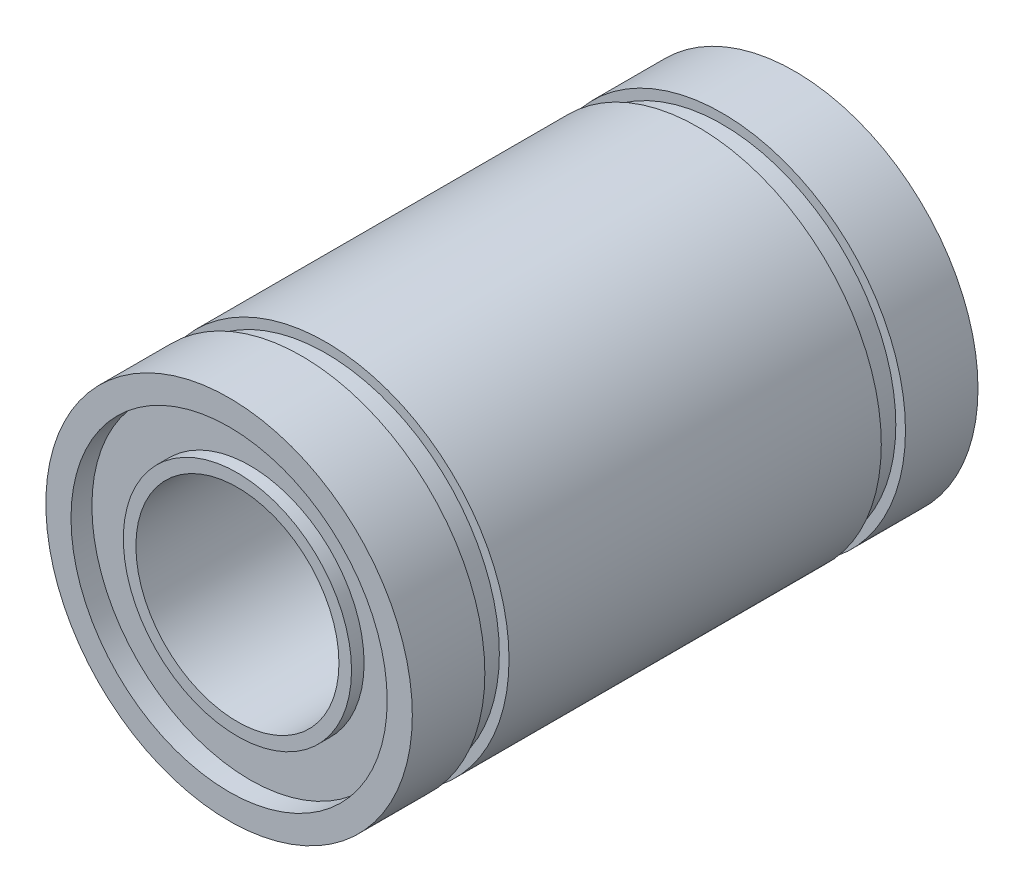
from build123d import *

# Parameters (mm, degrees)
SKETCH1_R                    = 9.475
BOSS_EXTRUDE1_DEPTH          = 29.25
SKETCH2_W                    = 0.5
SKETCH2_H                    = 1.25
SKETCH3_W                    = 8.175
SKETCH3_H                    = 1.1
F_10_5_10_5_DIAMETER_HOLE1_D = 10.5
SKETCH10_W                   = 0.65
SKETCH10_H                   = 0.65


with BuildPart() as part:
    # Sketch1 → Boss-Extrude1 (new body)
    with BuildSketch(Plane.XY):
        Circle(SKETCH1_R)
    extrude(amount=BOSS_EXTRUDE1_DEPTH)

    # Sketch2 → Cut-Revolve1 (revolve, cut)
    with BuildSketch(Plane(origin=(0, 0, 0), x_dir=(1, 0, 0), z_dir=(0, 1, 0))):
        with Locations((9.225, -4.375)):
            Rectangle(SKETCH2_W, SKETCH2_H)
        with Locations((9.225, -24.875)):
            Rectangle(SKETCH2_W, SKETCH2_H)
    revolve(axis=Axis((0, 0, 29.25), (0, 0, -1)), mode=Mode.SUBTRACT)

    # Sketch3 → Cut-Revolve2 (revolve, cut)
    with BuildSketch(Plane(origin=(0, 0, 0), x_dir=(1, 0, 0), z_dir=(0, 1, 0))):
        with Locations((4.0875, -0.55)):
            Rectangle(SKETCH3_W, SKETCH3_H)
    cut_revolve2 = revolve(axis=Axis((0, 0, 29.25), (0, 0, -1)), mode=Mode.SUBTRACT)

    # Mirror1: Cut-Revolve2 across plane
    add(cut_revolve2.mirror(Plane.XY.offset(14.634530548)), mode=Mode.SUBTRACT)

    # Ø10.5 (10.5) Diameter Hole1 (through all)
    with Locations(Plane(origin=(0, 0, 1.1), x_dir=(-1, 0, 0), z_dir=(0, 0, -1))):
        with Locations((0, 0)):
            Hole(F_10_5_10_5_DIAMETER_HOLE1_D / 2)

    # Sketch10 → Revolve1 (revolve)
    with BuildSketch(Plane(origin=(0, 0, 0), x_dir=(0, 0, -1), z_dir=(1, 0, 0)), mode=Mode.PRIVATE) as revolve1_sk:
        with Locations((-0.775, 5.575)):
            Rectangle(SKETCH10_W, SKETCH10_H)
    revolve1 = revolve(revolve1_sk.sketch.rotate(Axis((0, 0, 29.269061095), (0, 0, -1)), 270), axis=Axis((0, 0, 29.269061095), (0, 0, -1)))

    # Mirror2: Revolve1 across plane
    add(revolve1.mirror(Plane.XY.offset(14.634530548)))


solid = part.part
